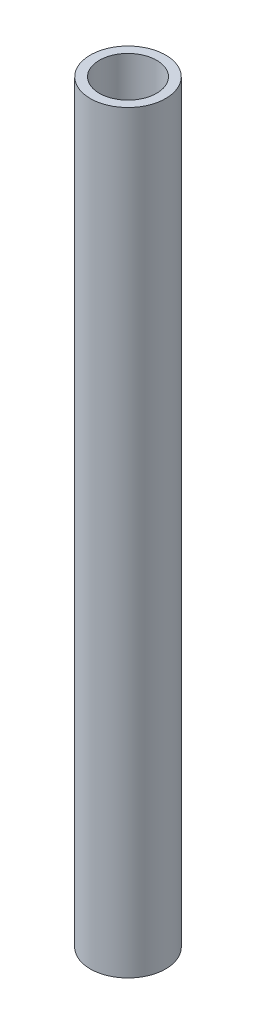
from build123d import *

# Parameters (mm, degrees)
SKETCH_1_R      = 5
SKETCH_1_R_2    = 3.8
EXTRUDE_1_DEPTH = 100


with BuildPart() as part:
    # 草图1 → 凸台-拉伸1 (new body)
    with BuildSketch(Plane(origin=(0, 0, 0), x_dir=(1, 0, 0), z_dir=(0, 1, 0))):
        with Locations(Location((0, 0, 0), (0, 0, 270))):
            Circle(SKETCH_1_R)
        with Locations(Location((0, 0, 0), (0, 0, 270))):
            Circle(SKETCH_1_R_2, mode=Mode.SUBTRACT)
    extrude(amount=EXTRUDE_1_DEPTH)


solid = part.part
